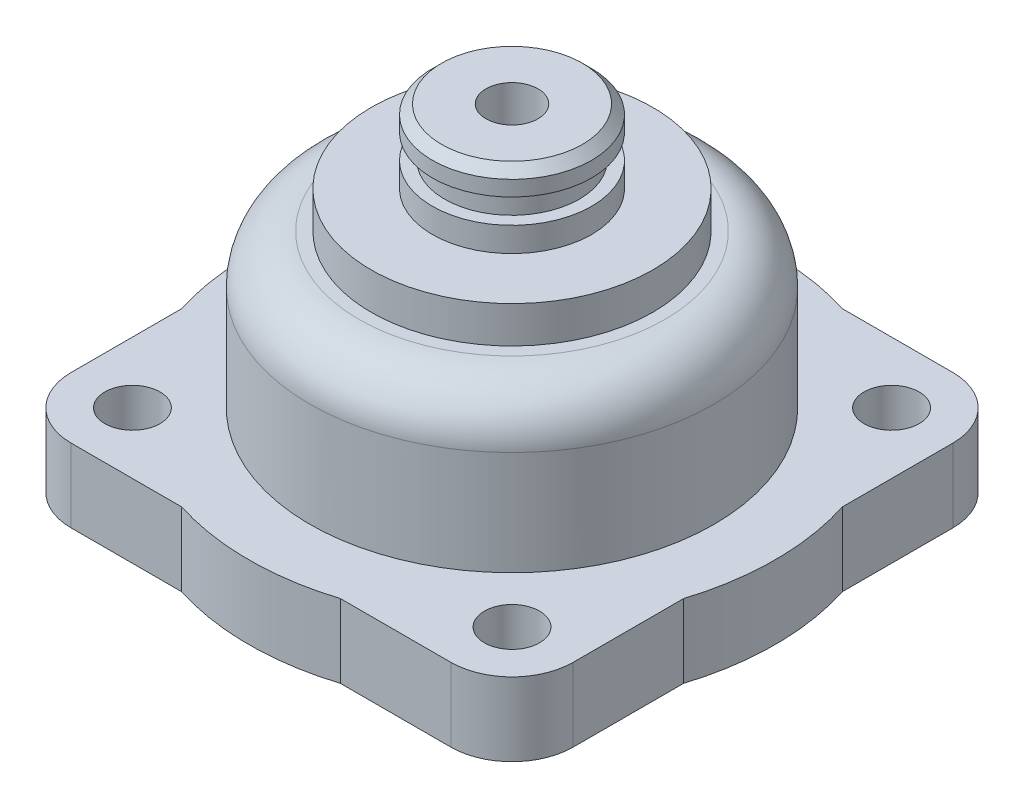
from build123d import *

# Parameters (mm, degrees)
SKETCH_1_R          = 4.5
EXTRUDE_1_DEPTH     = 12
FILLET_1_R          = 8
SKETCH_3_R          = 25
CUT_EXTRUDE_1_DEPTH = 29
FILLET_2_R          = 2
HOLE_WIZARD_M10_1_D = 8.5


with BuildPart() as part:
    # 草图1 → 凸台-拉伸1 (new body)
    with BuildSketch(Plane(origin=(0, 0, 0), x_dir=(1, 0, 0), z_dir=(0, 1, 0))):
        with BuildLine():
            Line((-41, 12.961481397), (-41, 31))
            ThreePointArc((-41, 31), (-38.071067812, 38.071067812), (-31, 41))
            Line((-31, 41), (-12.961481397, 41))
            ThreePointArc((-12.961481397, 41), (0, 43), (12.961481397, 41))
            Line((12.961481397, 41), (31, 41))
            ThreePointArc((31, 41), (38.071067812, 38.071067812), (41, 31))
            Line((41, 31), (41, 12.961481397))
            ThreePointArc((41, 12.961481397), (43, 0), (41, -12.961481397))
            Line((41, -12.961481397), (41, -31))
            ThreePointArc((41, -31), (38.071067812, -38.071067812), (31, -41))
            Line((31, -41), (12.961481397, -41))
            ThreePointArc((12.961481397, -41), (0, -43), (-12.961481397, -41))
            Line((-12.961481397, -41), (-31, -41))
            ThreePointArc((-31, -41), (-38.071067812, -38.071067812), (-41, -31))
            Line((-41, -31), (-41, -12.961481397))
            ThreePointArc((-41, -12.961481397), (-43, 0), (-41, 12.961481397))
        make_face()
        with Locations(Location((-31, 31, 0), (0, 0, 270))):
            Circle(SKETCH_1_R, mode=Mode.SUBTRACT)
        with Locations(Location((31, 31, 0), (0, 0, 270))):
            Circle(SKETCH_1_R, mode=Mode.SUBTRACT)
        with Locations(Location((31, -31, 0), (0, 0, 270))):
            Circle(SKETCH_1_R, mode=Mode.SUBTRACT)
        with Locations(Location((-31, -31, 0), (0, 0, 270))):
            Circle(SKETCH_1_R, mode=Mode.SUBTRACT)
    extrude(amount=EXTRUDE_1_DEPTH)

    # 草图2 → 旋转1 (revolve)
    with BuildSketch(Plane.XY):
        Polygon((0, 12), (33, 12), (33, 37), (23, 37), (23, 43), (13, 43), (13, 47), (11, 47), (11, 51), (13, 51), (13, 53.5), (11.5, 55), (0, 55), align=None)
    revolve(axis=Axis((0, 12, 0), (0, 1, 0)))

    # 圆角1
    fillet_1_edges = [part.edges().sort_by_distance(p)[0] for p in [
        (-33, 37, 0),
    ]]
    fillet(fillet_1_edges, radius=FILLET_1_R)

    # 草图3 → 切除-拉伸1 (cut)
    with BuildSketch(Plane.XZ):
        with Locations(Location((0, 0, 0), (0, 0, 270))):
            Circle(SKETCH_3_R)
    extrude(amount=-CUT_EXTRUDE_1_DEPTH, mode=Mode.SUBTRACT)

    # 圆角2
    fillet_2_edges = [part.edges().sort_by_distance(p)[0] for p in [
        (0, 29, 25),
    ]]
    fillet(fillet_2_edges, radius=FILLET_2_R)

    # M10 螺纹孔1 (through all)
    with Locations(Plane(origin=(0, 55, 0), x_dir=(1, 0, 0), z_dir=(0, 1, 0))):
        with Locations((0, 0)):
            Hole(HOLE_WIZARD_M10_1_D / 2)


solid = part.part
